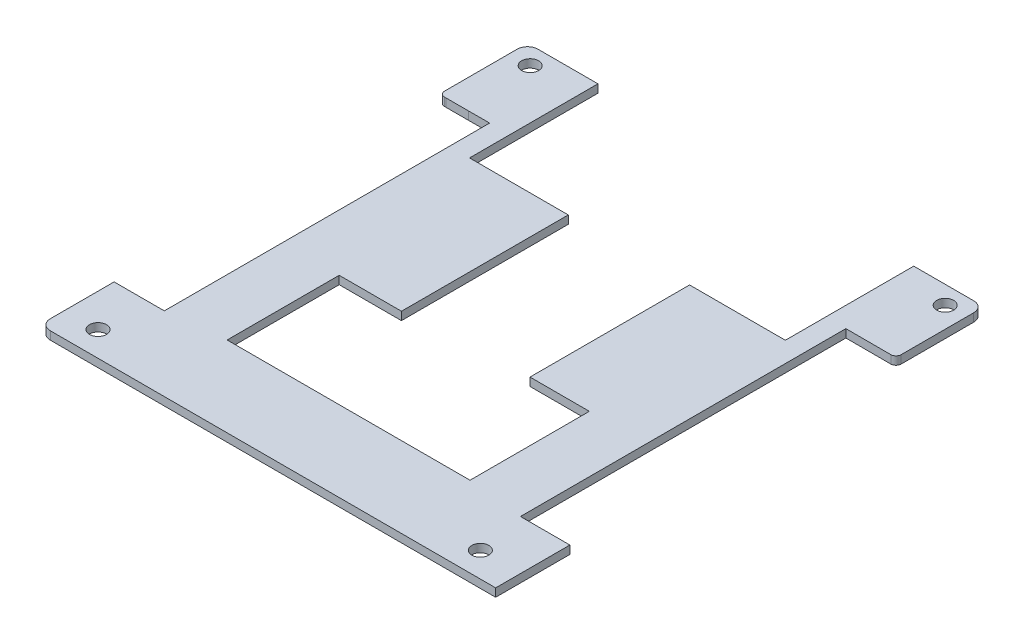
from build123d import *

# Parameters (mm, degrees)
SKETCH1_2_R                 = 1.6383
BOSS_EXTRUDE2_DEPTH         = 1.575
SKETCH2_W                   = 14.080651801
SKETCH2_H                   = 7.11628052
SKETCH2_W_2                 = 15.007196354
SKETCH2_H_2                 = 9.421332762
CUT_EXTRUDE1_DEPTH          = 65.400942629
ADDITIONAL_PCB_MATERIAL_W   = 2.649520344
ADDITIONAL_PCB_MATERIAL_H   = 65.213315835
ADDITIONAL_PCB_MATERIAL_W_2 = 1.5
ADDITIONAL_PCB_MATERIAL_H_2 = 65.299191064
BOSS_EXTRUDE3_DEPTH         = 1.575


with BuildPart() as part:
    # Sketch1<2> → Boss-Extrude2 (new body)
    with BuildSketch(Plane(origin=(0, 0, 0), x_dir=(1, 0, 0), z_dir=(0, 1, 0))):
        with BuildLine():
            Line((-38.39500299, 29.999999735), (-42.73000299, 29.999999735))
            Line((-42.73000299, 29.999999735), (-43.011025994, 30.003097626))
            ThreePointArc((-43.011025994, 30.003097626), (-43.710996344, 30.299838092), (-44.000003042, 31.003036872))
            Line((-44.000003042, 31.003036872), (-44.000003042, 31.269999735))
            Line((-44.000003042, 31.269999735), (-44.000005679, 44.999999735))
            ThreePointArc((-44.000005679, 44.999999735), (-43.414218633, 46.414215608), (-42.000002924, 47.000003051))
            Line((-42.000002924, 47.000003051), (-30.435003, 47.000003051))
            Line((-30.435003, 47.000003051), (-30.435003, 22.255357341))
            Line((-30.435003, 22.255357341), (-11.409003, 22.255357341))
            Line((-11.409003, 22.255357341), (-11.409003, -9.899999999))
            Line((-11.409003, -9.899999999), (-23.409003, -9.899999999))
            Line((-23.409003, -9.899999999), (-23.409003, -31.499996949))
            Line((-23.409003, -31.499996949), (23.408997, -31.499996949))
            Line((23.408997, -31.499996949), (23.408997, -8.499997555))
            Line((23.408997, -8.499997555), (11.97084713, -8.499997555))
            Line((11.97084713, -8.499997555), (11.97084713, 22.255357341))
            Line((11.97084713, 22.255357341), (30.434997, 22.255357341))
            Line((30.434997, 22.255357341), (30.434997, 47.000003051))
            Line((30.434997, 47.000003051), (42.000008541, 47.000003051))
            ThreePointArc((42.000008541, 47.000003051), (43.414213215, 46.414220704), (43.999996956, 45.000016607))
            Line((43.999996956, 45.000016607), (43.999996956, 32.000003378))
            Line((43.999996956, 32.000003378), (43.999996956, 31.015615364))
            ThreePointArc((43.999996956, 31.015615364), (43.706534093, 30.307939396), (42.998386406, 30.015616661))
            Line((42.998386406, 30.015616661), (33.825607551, 30.030389905))
            ThreePointArc((33.825607551, 30.030389905), (33.117459864, 29.738067169), (32.823997, 29.030391202))
            Line((32.823997, 29.030391202), (32.823997, -30.453996949))
            ThreePointArc((32.823997, -30.453996949), (33.116890219, -31.16110373), (33.823997, -31.453996949))
            Line((33.823997, -31.453996949), (36.099999555, -31.453996949))
            Line((36.099999555, -31.453996949), (42.849728118, -31.453996949))
            ThreePointArc((42.849728118, -31.453996949), (43.556834899, -31.746890168), (43.849728118, -32.453996949))
            Line((43.849728118, -32.453996949), (43.849728118, -36.999996949))
            Line((43.849728118, -36.999996949), (43.849728118, -46.999996949))
            Line((43.849728118, -46.999996949), (-42.000000178, -46.999996949))
            ThreePointArc((-42.000000178, -46.999996949), (-43.414212804, -46.414211581), (-44.000000499, -44.999999921))
            Line((-44.000000499, -44.999999921), (-44.000000178, -38.976999921))
            Line((-44.000000178, -38.976999921), (-44.000000178, -32.453999802))
            ThreePointArc((-44.000000178, -32.453999802), (-43.70710696, -31.746893021), (-43.000000178, -31.453999802))
            Line((-43.000000178, -31.453999802), (-36.100000549, -31.453999802))
            Line((-36.100000549, -31.453999802), (-33.824003042, -31.453999802))
            ThreePointArc((-33.824003042, -31.453999802), (-33.116896261, -31.161106583), (-32.824003042, -30.453999802))
            Line((-32.824003042, -30.453999802), (-32.824003042, 29.011483943))
            ThreePointArc((-32.824003042, 29.011483943), (-33.117785331, 29.719478678), (-33.826516131, 30.011480785))
            Line((-33.826516131, 30.011480785), (-38.39500299, 29.999999735))
        make_face()
        with Locations((40, 43.5)):
            Circle(SKETCH1_2_R, mode=Mode.SUBTRACT)
        with Locations((-40, 43.5)):
            Circle(SKETCH1_2_R, mode=Mode.SUBTRACT)
        with Locations((-37.6, -42.2)):
            Circle(SKETCH1_2_R, mode=Mode.SUBTRACT)
        with Locations((36.1, -42.2)):
            Circle(SKETCH1_2_R, mode=Mode.SUBTRACT)
    extrude(amount=BOSS_EXTRUDE2_DEPTH)

    # Sketch2 → Cut-Extrude1 (cut, through all)
    with BuildSketch(Plane(origin=(0, 1.575, 0), x_dir=(1, 0, 0), z_dir=(0, 1, 0))):
        with Locations((39.863054019, -29.135856689)):
            Rectangle(SKETCH2_W, SKETCH2_H)
        with Locations((-40.336598676, -27.983330568)):
            Rectangle(SKETCH2_W_2, SKETCH2_H_2)
    extrude(amount=-CUT_EXTRUDE1_DEPTH, mode=Mode.SUBTRACT)

    # Additional PCB material → Boss-Extrude3 (add)
    with BuildSketch(Plane(origin=(0, 1.575, 0), x_dir=(1, 0, 0), z_dir=(0, 1, 0))):
        with Locations((32.999236828, -1.128517583)):
            Rectangle(ADDITIONAL_PCB_MATERIAL_W, ADDITIONAL_PCB_MATERIAL_H)
        with Locations((-33.574003042, -1.085579968)):
            Rectangle(ADDITIONAL_PCB_MATERIAL_W_2, ADDITIONAL_PCB_MATERIAL_H_2)
    extrude(amount=-BOSS_EXTRUDE3_DEPTH)


solid = part.part
